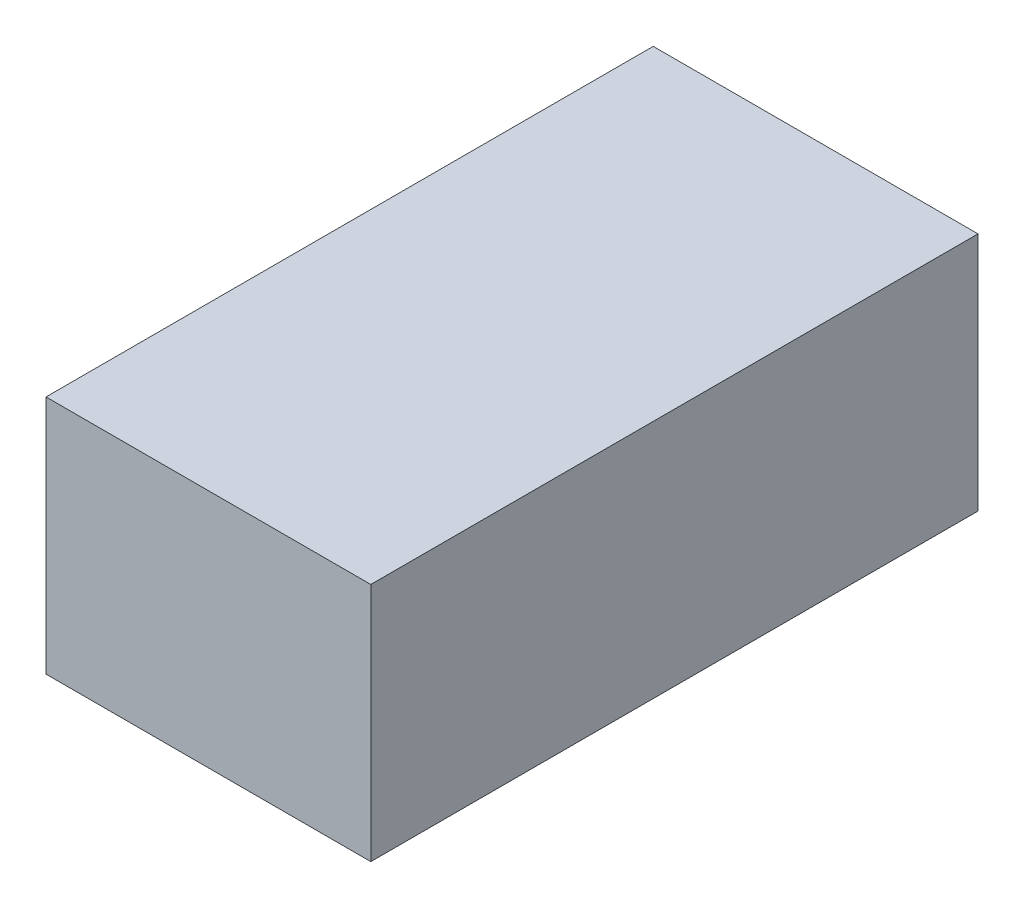
from build123d import *

# Parameters (mm, degrees)
SKETCH1_W           = 23
SKETCH1_H           = 17
BOSS_EXTRUDE1_DEPTH = 43


with BuildPart() as part:
    # Sketch1 → Boss-Extrude1 (new body)
    with BuildSketch(Plane.XY):
        with Locations((11.5, 8.5)):
            Rectangle(SKETCH1_W, SKETCH1_H)
    extrude(amount=BOSS_EXTRUDE1_DEPTH)


solid = part.part
